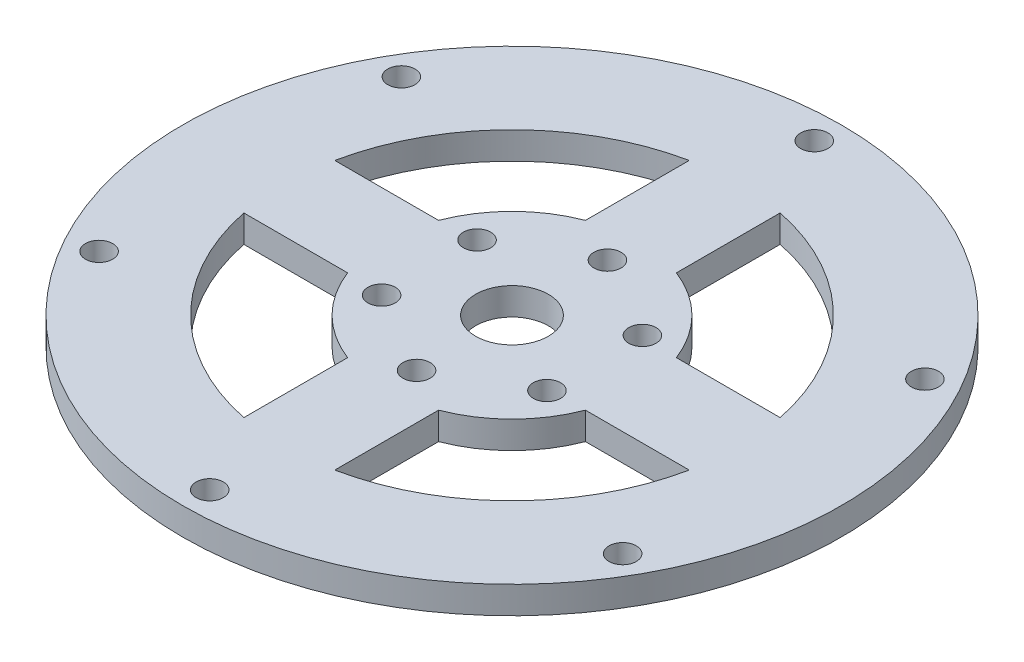
from build123d import *

# Parameters (mm, degrees)
SKETCH1_R           = 36.25
BOSS_EXTRUDE1_DEPTH = 3
SKETCH2_R           = 1.5
CUT_EXTRUDE1_DEPTH  = 52.352945388
SKETCH3_R           = 4
CUT_EXTRUDE2_DEPTH  = 8
CIRPATTERN1_COUNT   = 6
SKETCH4_R           = 1.5
CUT_EXTRUDE3_DEPTH  = 52.352945388
CIRPATTERN2_COUNT   = 6


with BuildPart() as part:
    # Sketch1 → Boss-Extrude1 (new body)
    with BuildSketch(Plane(origin=(0, 0, 0), x_dir=(1, 0, 0), z_dir=(0, 1, 0))):
        Circle(SKETCH1_R)
    extrude(amount=BOSS_EXTRUDE1_DEPTH)

    # Sketch2 → Cut-Extrude1 (cut, symmetric)
    with BuildSketch(Plane(origin=(0, 3, 0), x_dir=(1, 0, 0), z_dir=(0, 1, 0))):
        with Locations((0, 33.25)):
            Circle(SKETCH2_R)
    cut_extrude1 = extrude(amount=CUT_EXTRUDE1_DEPTH, both=True, mode=Mode.SUBTRACT)

    # Sketch3 → Cut-Extrude2 (cut)
    with BuildSketch(Plane(origin=(0, 3, 0), x_dir=(1, 0, 0), z_dir=(0, 1, 0))):
        with BuildLine():
            Line((-5, 13.076696831), (-5, 24.494897428))
            ThreePointArc((-5, 24.494897428), (-17.67766953, 17.67766953), (-24.494897428, 5))
            Line((-24.494897428, 5), (-13.076696831, 5))
            ThreePointArc((-13.076696831, 5), (-9.899494937, 9.899494937), (-5, 13.076696831))
        make_face()
        with BuildLine():
            ThreePointArc((24.494897428, 5), (17.67766953, 17.67766953), (5, 24.494897428))
            Line((5, 24.494897428), (5, 13.076696831))
            ThreePointArc((5, 13.076696831), (9.899494937, 9.899494937), (13.076696831, 5))
            Line((13.076696831, 5), (24.494897428, 5))
        make_face()
        with BuildLine():
            ThreePointArc((5, -24.494897428), (17.67766953, -17.67766953), (24.494897428, -5))
            Line((24.494897428, -5), (13.076696831, -5))
            ThreePointArc((13.076696831, -5), (9.899494937, -9.899494937), (5, -13.076696831))
            Line((5, -13.076696831), (5, -24.494897428))
        make_face()
        with BuildLine():
            ThreePointArc((-24.494897428, -5), (-17.67766953, -17.67766953), (-5, -24.494897428))
            Line((-5, -24.494897428), (-5, -13.076696831))
            ThreePointArc((-5, -13.076696831), (-9.899494937, -9.899494937), (-13.076696831, -5))
            Line((-13.076696831, -5), (-24.494897428, -5))
        make_face()
        Circle(SKETCH3_R)
    extrude(amount=-CUT_EXTRUDE2_DEPTH, mode=Mode.SUBTRACT)

    # CirPattern1: Cut-Extrude1 ×6 about axis
    cirpattern1_axis = Axis((0, 3, 0), (0, -1, 0))
    for i in range(1, CIRPATTERN1_COUNT):
        add(cut_extrude1.rotate(cirpattern1_axis, i * 360 / CIRPATTERN1_COUNT), mode=Mode.SUBTRACT)

    # Sketch4 → Cut-Extrude3 (cut, through all)
    with BuildSketch(Plane(origin=(0, 3, 0), x_dir=(1, 0, 0), z_dir=(0, 1, 0))):
        with Locations((0, 10.5)):
            Circle(SKETCH4_R)
    cut_extrude3 = extrude(amount=-CUT_EXTRUDE3_DEPTH, mode=Mode.SUBTRACT)

    # CirPattern2: Cut-Extrude3 ×6 about axis
    cirpattern2_axis = Axis((0, 3, 0), (0, -1, 0))
    for i in range(1, CIRPATTERN2_COUNT):
        add(cut_extrude3.rotate(cirpattern2_axis, i * 360 / CIRPATTERN2_COUNT), mode=Mode.SUBTRACT)


solid = part.part
